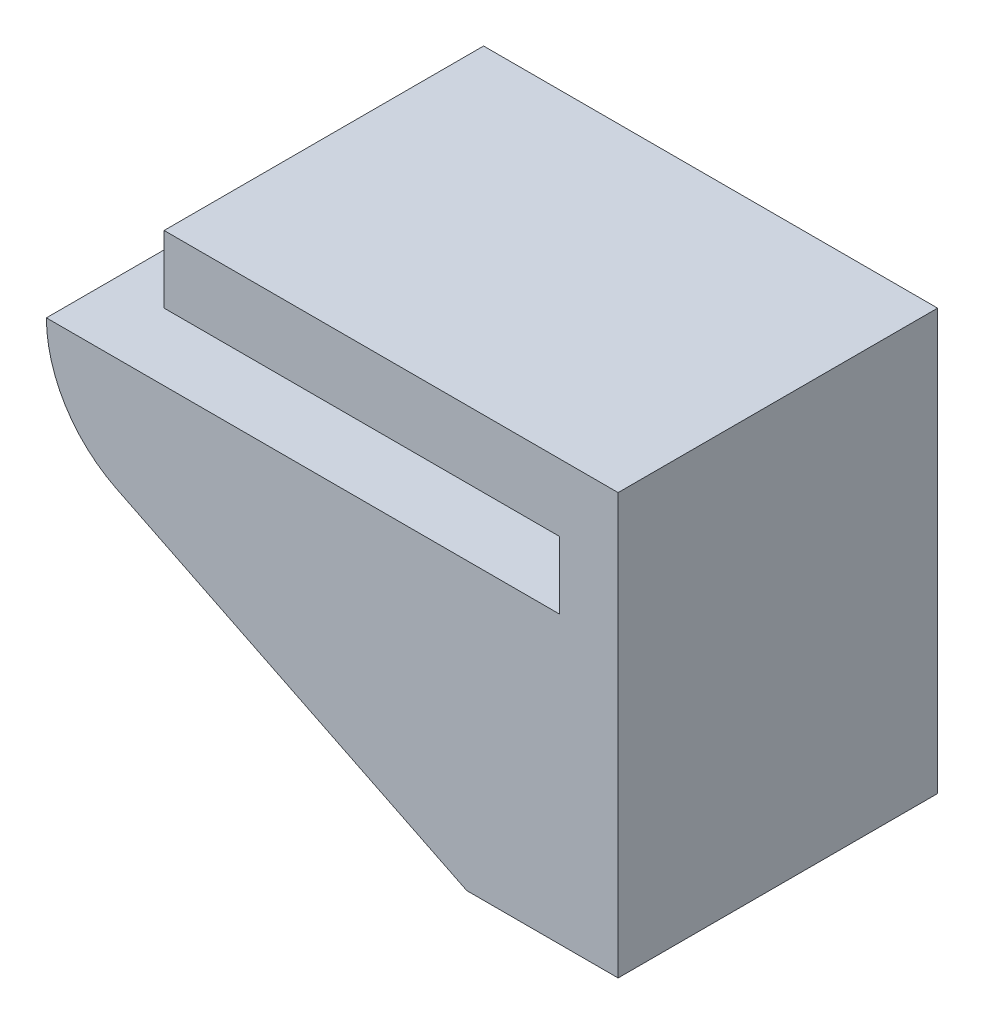
from build123d import *

# Parameters (mm, degrees)
BOSS_EXTRUDE1_DEPTH = 19


with BuildPart() as part:
    # Sketch1 → Boss-Extrude1 (new body)
    with BuildSketch(Plane.XY):
        with BuildLine():
            Line((0, 8), (0, -17))
            Line((0, -17), (-9, -17))
            Line((-9, -17), (-29.819130828, -6.725575852))
            ThreePointArc((-29.819130828, -6.725575852), (-32.869595011, -3.959578184), (-34, 0))
            Line((-34, 0), (-3.5, 0))
            Line((-3.5, 0), (-3.5, 4))
            Line((-3.5, 4), (-27, 4))
            Line((-27, 4), (-27, 8))
            Line((-27, 8), (0, 8))
        make_face()
    extrude(amount=BOSS_EXTRUDE1_DEPTH)


solid = part.part
